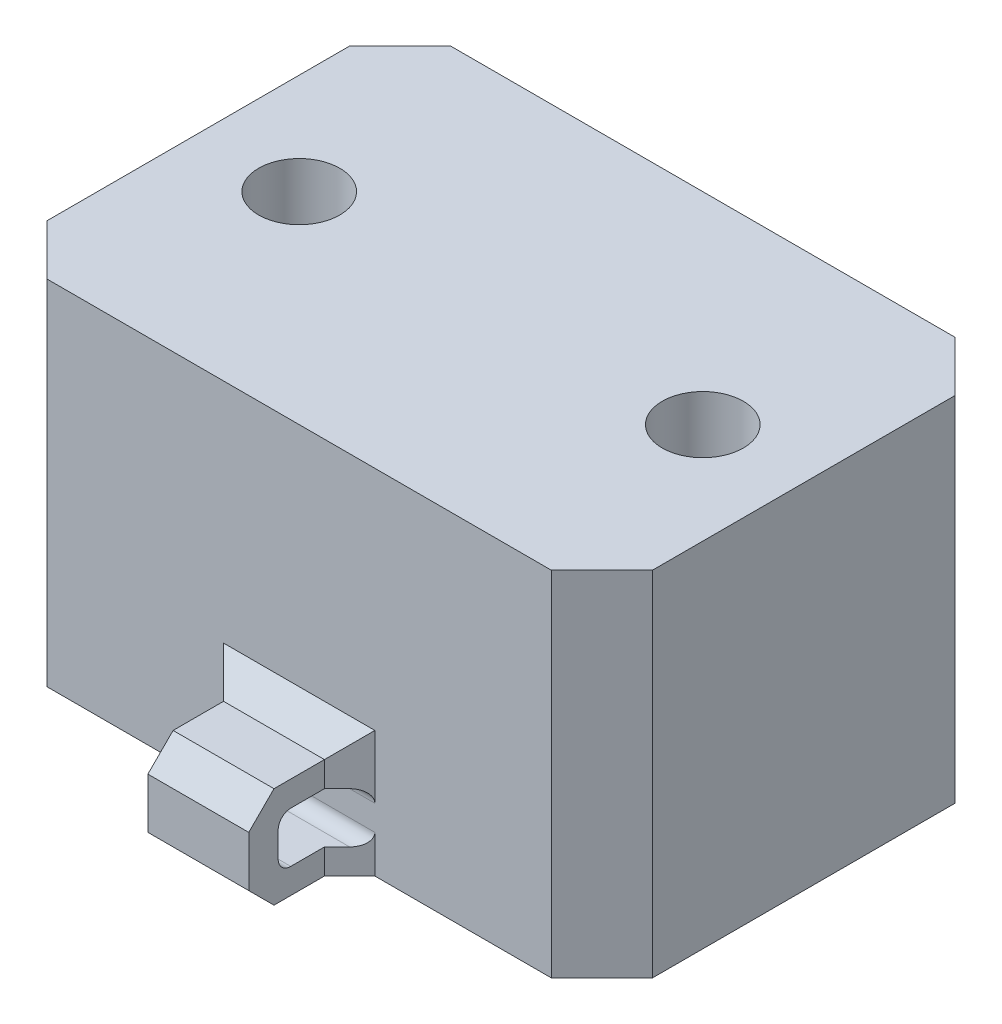
from build123d import *

# Parameters (mm, degrees)
SKETCH1_W              = 38.1
SKETCH1_H              = 25.4
BOSS_EXTRUDE1_DEPTH    = 22.225
F_10_CLEARANCE_HOLE1_D = 5.1054
CHAMFER1_SIZE          = 3.175
SKETCH6_W              = 6.35
SKETCH6_H              = 6.35
BOSS_EXTRUDE3_DEPTH    = 6.35
CUT_EXTRUDE1_REACH     = 38.753
SKETCH7_W              = 4.5
SKETCH7_H              = 3.175
CHAMFER4_SIZE          = 1.5875
CHAMFER5_SIZE          = 1.5875
FILLET2_R              = 0.79375


with BuildPart() as part:
    # Sketch1 → Boss-Extrude1 (new body)
    with BuildSketch(Plane(origin=(0, 0, 0), x_dir=(1, 0, 0), z_dir=(0, 1, 0))):
        Rectangle(SKETCH1_W, SKETCH1_H)
    extrude(amount=BOSS_EXTRUDE1_DEPTH)

    # #10 Clearance Hole1 (through all)
    with Locations(Plane(origin=(0, 22.225, 0), x_dir=(1, 0, 0), z_dir=(0, 1, 0))):
        with Locations((-12.7, 0), (12.7, 0)):
            Hole(F_10_CLEARANCE_HOLE1_D / 2)

    # Chamfer1
    chamfer1_edges = [part.edges().sort_by_distance(p)[0] for p in [
        (19.05, 11.1125, 12.7),
        (-19.05, 11.1125, 12.7),
        (-19.05, 11.1125, -12.7),
        (19.05, 11.1125, -12.7),
    ]]
    chamfer(chamfer1_edges, length=CHAMFER1_SIZE)

    # Sketch6 → Boss-Extrude3 (add)
    with BuildSketch(Plane.XY.offset(12.7)):
        with Locations((0, 3.175)):
            Rectangle(SKETCH6_W, SKETCH6_H)
    extrude(amount=BOSS_EXTRUDE3_DEPTH)

    # Sketch7 → Cut-Extrude1 (cut, up to next)
    with BuildSketch(Plane.ZY.offset(3.175), mode=Mode.PRIVATE) as cut_extrude1_sk1:
        with Locations((14.95, 3.175)):
            Rectangle(SKETCH7_W, SKETCH7_H)
    cut_extrude1_tool1 = extrude(cut_extrude1_sk1.sketch, amount=-CUT_EXTRUDE1_REACH, mode=Mode.PRIVATE) & part.part
    add(cut_extrude1_tool1.solids().sort_by_distance((-3.175, 3.175, 14.95))[0], mode=Mode.SUBTRACT)

    # Chamfer4
    chamfer4_edges = [part.edges().sort_by_distance(p)[0] for p in [
        (0, 0, 19.05),
        (0, 6.35, 19.05),
    ]]
    chamfer(chamfer4_edges, length=CHAMFER4_SIZE)

    # Chamfer5
    chamfer5_edges = [part.edges().sort_by_distance(p)[0] for p in [
        (-3.175, 5.55625, 12.7),
        (3.175, 0.79375, 12.7),
        (0, 6.35, 12.7),
        (3.175, 5.55625, 12.7),
        (-3.175, 0.79375, 12.7),
    ]]
    chamfer(chamfer5_edges, length=CHAMFER5_SIZE)

    # Fillet2
    fillet2_edges = [part.edges().sort_by_distance(p)[0] for p in [
        (0, 4.7625, 17.2),
        (0, 1.5875, 17.2),
        (0, 1.5875, 12.7),
        (0, 4.7625, 12.7),
    ]]
    fillet(fillet2_edges, radius=FILLET2_R)


solid = part.part
